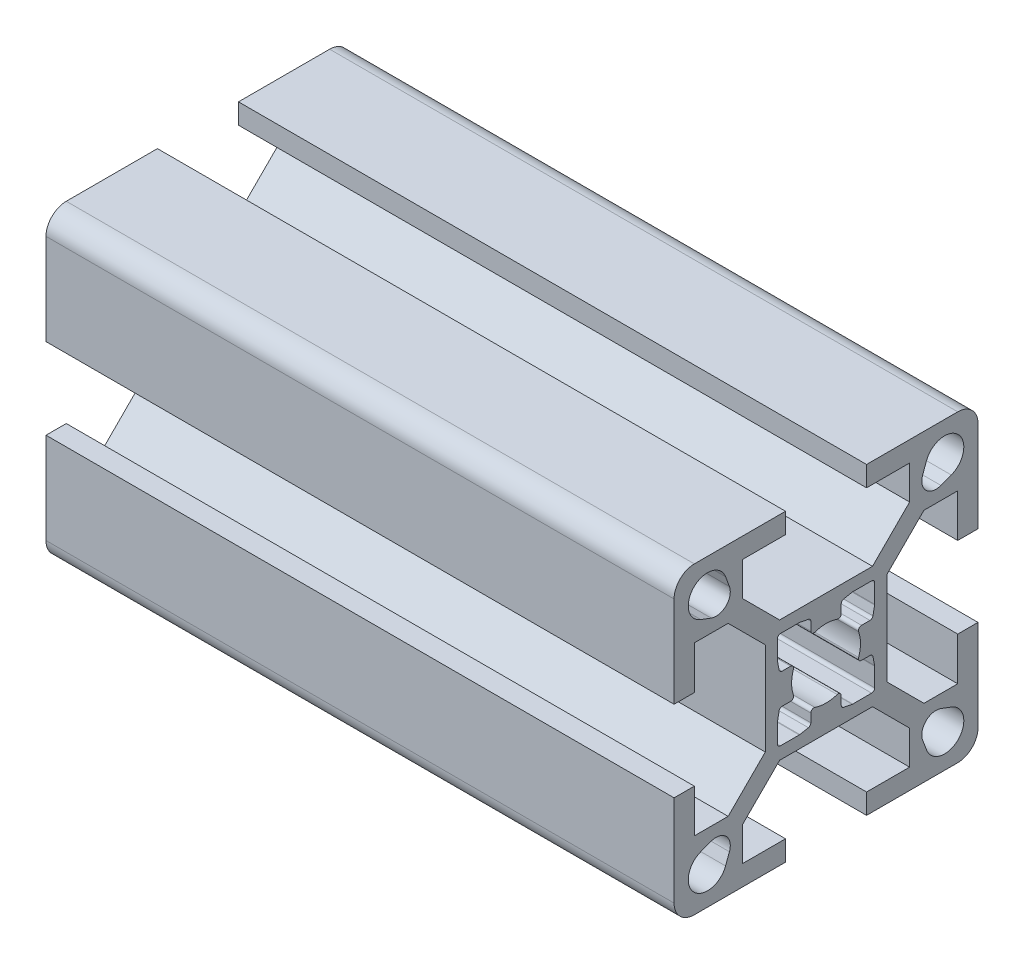
from build123d import *

# Parameters (mm, degrees)
BOSS_EXTRUDE1_DEPTH = 62


with BuildPart() as part:
    # Sketch1 → Boss-Extrude1 (new body)
    with BuildSketch(Plane(origin=(0, 0, 0), x_dir=(0, 0, -1), z_dir=(1, 0, 0))):
        with BuildLine():
            Line((-15, 13), (-15, 4))
            Line((-15, 4), (-13, 4))
            Line((-13, 4), (-13, 8.25))
            Line((-13, 8.25), (-9.664213562, 8.25))
            Line((-9.664213562, 8.25), (-6, 4.585786438))
            Line((-6, 4.585786438), (-6, -4.585786438))
            Line((-6, -4.585786438), (-9.664213562, -8.25))
            Line((-9.664213562, -8.25), (-13, -8.25))
            Line((-13, -8.25), (-13, -4))
            Line((-13, -4), (-15, -4))
            Line((-15, -4), (-15, -13))
            ThreePointArc((-15, -13), (-14.414213562, -14.414213562), (-13, -15))
            Line((-13, -15), (-4, -15))
            Line((-4, -15), (-4, -13))
            Line((-4, -13), (-8.25, -13))
            Line((-8.25, -13), (-8.25, -9.664213562))
            Line((-8.25, -9.664213562), (-4.585786438, -6))
            Line((-4.585786438, -6), (4.585786438, -6))
            Line((4.585786438, -6), (8.25, -9.664213562))
            Line((8.25, -9.664213562), (8.25, -13))
            Line((8.25, -13), (4, -13))
            Line((4, -13), (4, -15))
            Line((4, -15), (13, -15))
            ThreePointArc((13, -15), (14.414213562, -14.414213562), (15, -13))
            Line((15, -13), (15, -4))
            Line((15, -4), (13, -4))
            Line((13, -4), (13, -8.25))
            Line((13, -8.25), (9.664213562, -8.25))
            Line((9.664213562, -8.25), (6, -4.585786438))
            Line((6, -4.585786438), (6, 4.585786438))
            Line((6, 4.585786438), (9.664213562, 8.25))
            Line((9.664213562, 8.25), (13, 8.25))
            Line((13, 8.25), (13, 4))
            Line((13, 4), (15, 4))
            Line((15, 4), (15, 13))
            ThreePointArc((15, 13), (14.414213562, 14.414213562), (13, 15))
            Line((13, 15), (4, 15))
            Line((4, 15), (4, 13))
            Line((4, 13), (8.25, 13))
            Line((8.25, 13), (8.25, 9.664213562))
            Line((8.25, 9.664213562), (4.585786438, 6))
            Line((4.585786438, 6), (-4.585786438, 6))
            Line((-4.585786438, 6), (-8.25, 9.664213562))
            Line((-8.25, 9.664213562), (-8.25, 13))
            Line((-8.25, 13), (-4, 13))
            Line((-4, 13), (-4, 15))
            Line((-4, 15), (-13, 15))
            ThreePointArc((-13, 15), (-14.414213562, 14.414213562), (-15, 13))
        make_face()
        with BuildLine():
            Line((-9.539070071, 11.338915743), (-9.918883282, 12.361530981))
            ThreePointArc((-9.918883282, 12.361530981), (-13.043502884, 13.043502884), (-12.361530981, 9.918883282))
            Line((-12.361530981, 9.918883282), (-11.338915743, 9.539070071))
            ThreePointArc((-11.338915743, 9.539070071), (-9.861522369, 9.861522369), (-9.539070071, 11.338915743))
        make_face(mode=Mode.SUBTRACT)
        with BuildLine():
            Line((9.918883282, 12.361530981), (9.539070071, 11.338915743))
            ThreePointArc((9.539070071, 11.338915743), (9.861522369, 9.861522369), (11.338915743, 9.539070071))
            Line((11.338915743, 9.539070071), (12.361530981, 9.918883282))
            ThreePointArc((12.361530981, 9.918883282), (13.043502884, 13.043502884), (9.918883282, 12.361530981))
        make_face(mode=Mode.SUBTRACT)
        with BuildLine():
            Line((12.361530981, -9.918883282), (11.338915743, -9.539070071))
            ThreePointArc((11.338915743, -9.539070071), (9.861522369, -9.861522369), (9.539070071, -11.338915743))
            Line((9.539070071, -11.338915743), (9.918883282, -12.361530981))
            ThreePointArc((9.918883282, -12.361530981), (13.043502884, -13.043502884), (12.361530981, -9.918883282))
        make_face(mode=Mode.SUBTRACT)
        with BuildLine():
            Line((-11.338915743, -9.539070071), (-12.361530981, -9.918883282))
            ThreePointArc((-12.361530981, -9.918883282), (-13.043502884, -13.043502884), (-9.918883282, -12.361530981))
            Line((-9.918883282, -12.361530981), (-9.539070071, -11.338915743))
            ThreePointArc((-9.539070071, -11.338915743), (-9.861522369, -9.861522369), (-11.338915743, -9.539070071))
        make_face(mode=Mode.SUBTRACT)
        with BuildLine():
            Line((-4.8, -2.644433572), (-4.8, -4.5))
            ThreePointArc((-4.8, -4.5), (-4.712132034, -4.712132034), (-4.5, -4.8))
            Line((-4.5, -4.8), (-2.644433572, -4.8))
            ThreePointArc((-2.644433572, -4.8), (-2.615679847, -4.79861886), (-2.587190874, -4.794488155))
            Line((-2.587190874, -4.794488155), (-1.742757301, -4.630346896))
            ThreePointArc((-1.742757301, -4.630346896), (-1.568512625, -4.526682207), (-1.5, -4.335858741))
            Line((-1.5, -4.335858741), (-1.5, -3.5))
            ThreePointArc((-1.5, -3.5), (-1.374371458, -3.255879959), (-1.102702703, -3.216216216))
            ThreePointArc((-1.102702703, -3.216216216), (0, -3.4), (1.102702703, -3.216216216))
            ThreePointArc((1.102702703, -3.216216216), (1.374371458, -3.255879959), (1.5, -3.5))
            Line((1.5, -3.5), (1.5, -4.335858741))
            ThreePointArc((1.5, -4.335858741), (1.568512625, -4.526682207), (1.742757301, -4.630346896))
            Line((1.742757301, -4.630346896), (2.587190874, -4.794488155))
            ThreePointArc((2.587190874, -4.794488155), (2.615679847, -4.79861886), (2.644433572, -4.8))
            Line((2.644433572, -4.8), (4.5, -4.8))
            ThreePointArc((4.5, -4.8), (4.712132034, -4.712132034), (4.8, -4.5))
            Line((4.8, -4.5), (4.8, -2.644433572))
            ThreePointArc((4.8, -2.644433572), (4.79861886, -2.615679847), (4.794488155, -2.587190874))
            Line((4.794488155, -2.587190874), (4.630346896, -1.742757301))
            ThreePointArc((4.630346896, -1.742757301), (4.526682207, -1.568512625), (4.335858741, -1.5))
            Line((4.335858741, -1.5), (3.5, -1.5))
            ThreePointArc((3.5, -1.5), (3.255879959, -1.374371458), (3.216216216, -1.102702703))
            ThreePointArc((3.216216216, -1.102702703), (3.4, 0), (3.216216216, 1.102702703))
            ThreePointArc((3.216216216, 1.102702703), (3.255879959, 1.374371458), (3.5, 1.5))
            Line((3.5, 1.5), (4.335858741, 1.5))
            ThreePointArc((4.335858741, 1.5), (4.526682207, 1.568512625), (4.630346896, 1.742757301))
            Line((4.630346896, 1.742757301), (4.794488155, 2.587190874))
            ThreePointArc((4.794488155, 2.587190874), (4.79861886, 2.615679847), (4.8, 2.644433572))
            Line((4.8, 2.644433572), (4.8, 4.5))
            ThreePointArc((4.8, 4.5), (4.712132034, 4.712132034), (4.5, 4.8))
            Line((4.5, 4.8), (2.644433572, 4.8))
            ThreePointArc((2.644433572, 4.8), (2.615679847, 4.79861886), (2.587190874, 4.794488155))
            Line((2.587190874, 4.794488155), (1.742757301, 4.630346896))
            ThreePointArc((1.742757301, 4.630346896), (1.568512625, 4.526682207), (1.5, 4.335858741))
            Line((1.5, 4.335858741), (1.5, 3.5))
            ThreePointArc((1.5, 3.5), (1.374371458, 3.255879959), (1.102702703, 3.216216216))
            ThreePointArc((1.102702703, 3.216216216), (0, 3.4), (-1.102702703, 3.216216216))
            ThreePointArc((-1.102702703, 3.216216216), (-1.374371458, 3.255879959), (-1.5, 3.5))
            Line((-1.5, 3.5), (-1.5, 4.335858741))
            ThreePointArc((-1.5, 4.335858741), (-1.568512625, 4.526682207), (-1.742757301, 4.630346896))
            Line((-1.742757301, 4.630346896), (-2.587190874, 4.794488155))
            ThreePointArc((-2.587190874, 4.794488155), (-2.615679847, 4.79861886), (-2.644433572, 4.8))
            Line((-2.644433572, 4.8), (-4.5, 4.8))
            ThreePointArc((-4.5, 4.8), (-4.712132034, 4.712132034), (-4.8, 4.5))
            Line((-4.8, 4.5), (-4.8, 2.644433572))
            ThreePointArc((-4.8, 2.644433572), (-4.79861886, 2.615679847), (-4.794488155, 2.587190874))
            Line((-4.794488155, 2.587190874), (-4.630346896, 1.742757301))
            ThreePointArc((-4.630346896, 1.742757301), (-4.526682207, 1.568512625), (-4.335858741, 1.5))
            Line((-4.335858741, 1.5), (-3.5, 1.5))
            ThreePointArc((-3.5, 1.5), (-3.255879959, 1.374371458), (-3.216216216, 1.102702703))
            ThreePointArc((-3.216216216, 1.102702703), (-3.4, 0), (-3.216216216, -1.102702703))
            ThreePointArc((-3.216216216, -1.102702703), (-3.255879959, -1.374371458), (-3.5, -1.5))
            Line((-3.5, -1.5), (-4.335858741, -1.5))
            ThreePointArc((-4.335858741, -1.5), (-4.526682207, -1.568512625), (-4.630346896, -1.742757301))
            Line((-4.630346896, -1.742757301), (-4.794488155, -2.587190874))
            ThreePointArc((-4.794488155, -2.587190874), (-4.79861886, -2.615679847), (-4.8, -2.644433572))
        make_face(mode=Mode.SUBTRACT)
    extrude(amount=BOSS_EXTRUDE1_DEPTH)


solid = part.part
